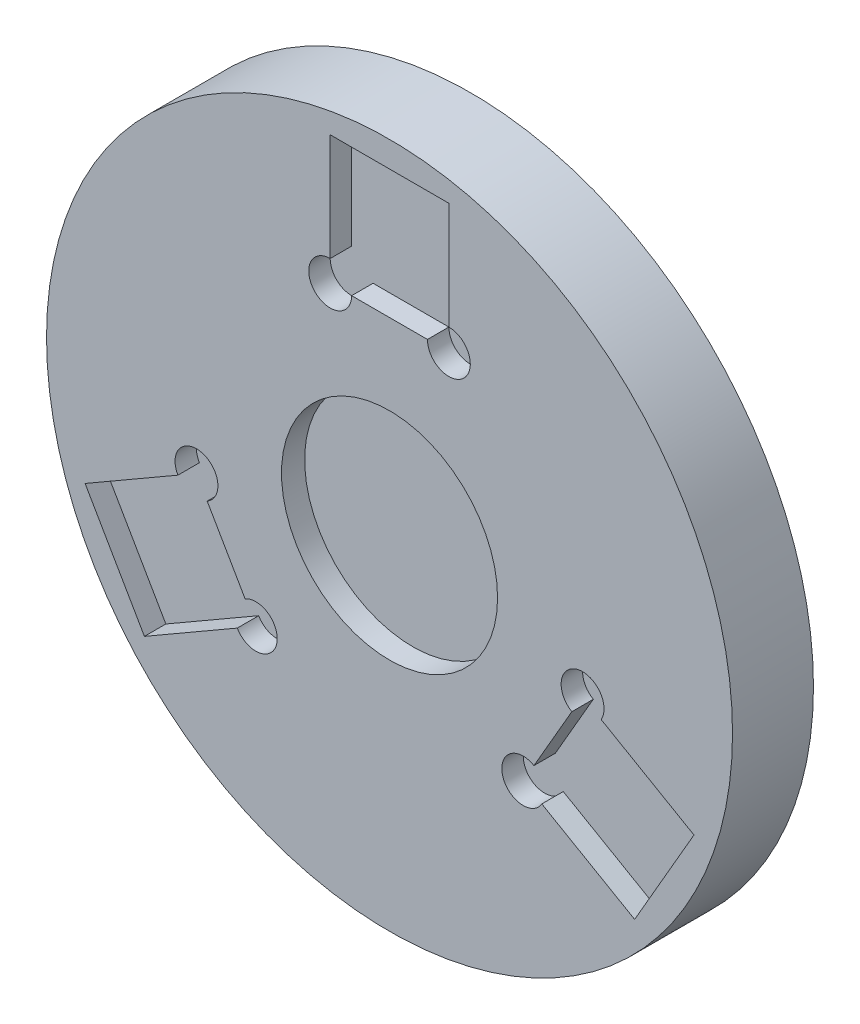
from build123d import *

# Parameters (mm, degrees)
SKETCH1_R           = 50.8
BOSS_EXTRUDE1_DEPTH = 11.9888
SKETCH3_W           = 17.57426
SKETCH3_H           = 19.05
POCKET_DEPTH        = 3.175
SKETCH7_R           = 3.175
CORNER_RELIEF_DEPTH = 3.175
CIRPATTERN1_COUNT   = 3
SKETCH5_R           = 16.002
MAGNET_INSET_DEPTH  = 3.429


with BuildPart() as part:
    # Sketch1 → Boss-Extrude1 (new body)
    with BuildSketch(Plane.XY):
        with Locations(Location((0, 0, 0), (0, 0, 180))):
            Circle(SKETCH1_R)
    extrude(amount=BOSS_EXTRUDE1_DEPTH)

    # Sketch3 → pocket (cut)
    with BuildSketch(Plane.XY.offset(11.9888)):
        with Locations((0, 37.465)):
            Rectangle(SKETCH3_W, SKETCH3_H)
    pocket = extrude(amount=-POCKET_DEPTH, mode=Mode.SUBTRACT)

    # Sketch7 → corner relief (cut)
    with BuildSketch(Plane.XY.offset(11.9888)):
        with Locations((-8.78713, 27.94)):
            Circle(SKETCH7_R)
        with Locations((8.78713, 27.94)):
            Circle(SKETCH7_R)
    corner_relief = extrude(amount=-CORNER_RELIEF_DEPTH, mode=Mode.SUBTRACT)

    # CirPattern1: pocket, corner relief ×3 about axis
    cirpattern1_axis = Axis((0, 0, 0), (0, 0, 1))
    add([pocket.rotate(cirpattern1_axis, i * 360 / CIRPATTERN1_COUNT) for i in range(1, CIRPATTERN1_COUNT)], mode=Mode.SUBTRACT)
    add([corner_relief.rotate(cirpattern1_axis, i * 360 / CIRPATTERN1_COUNT) for i in range(1, CIRPATTERN1_COUNT)], mode=Mode.SUBTRACT)

    # Sketch5 → magnet inset (cut)
    with BuildSketch(Plane.XY.offset(11.9888)):
        Circle(SKETCH5_R)
    extrude(amount=-MAGNET_INSET_DEPTH, mode=Mode.SUBTRACT)


solid = part.part
